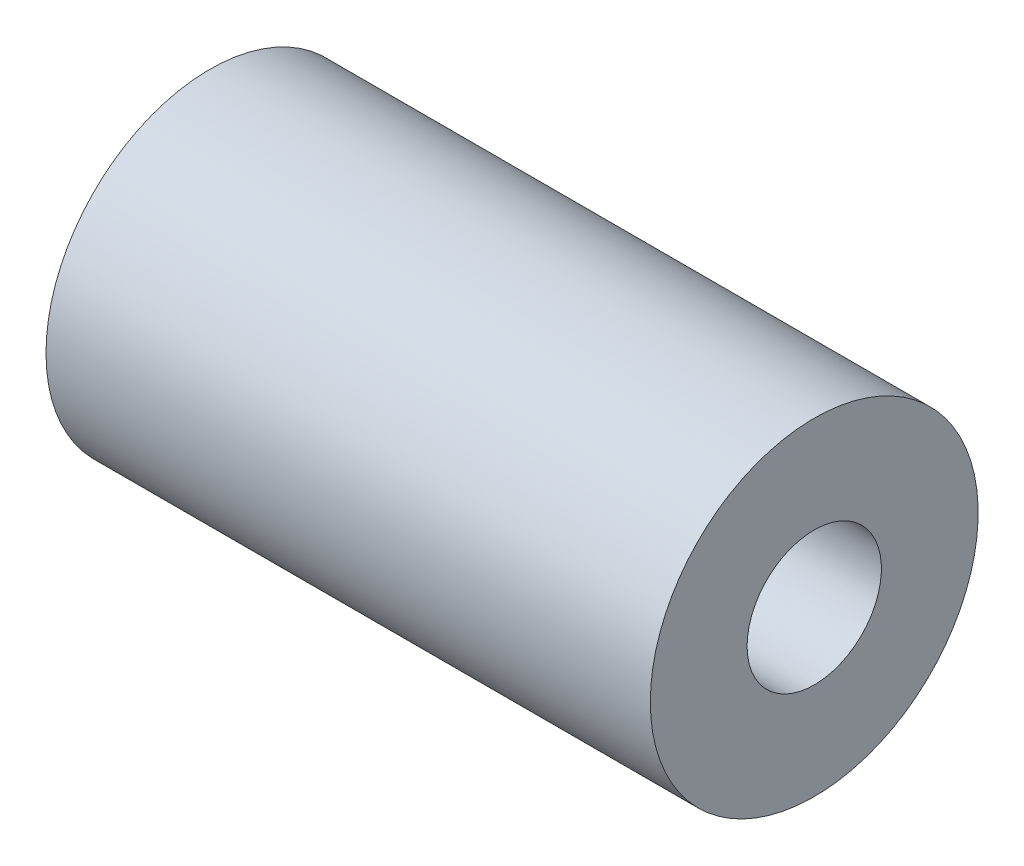
from build123d import *

# Parameters (mm, degrees)
SKETCH1_W = 57.15
SKETCH1_H = 9.15


with BuildPart() as part:
    # Sketch1 → Revolve1 (revolve)
    with BuildSketch(Plane.XY, mode=Mode.PRIVATE) as revolve1_sk:
        with Locations((28.575, -10.925)):
            Rectangle(SKETCH1_W, SKETCH1_H)
    revolve(revolve1_sk.sketch.rotate(Axis((0, 0, 0), (1, 0, 0)), 270), axis=Axis((0, 0, 0), (1, 0, 0)))


solid = part.part
